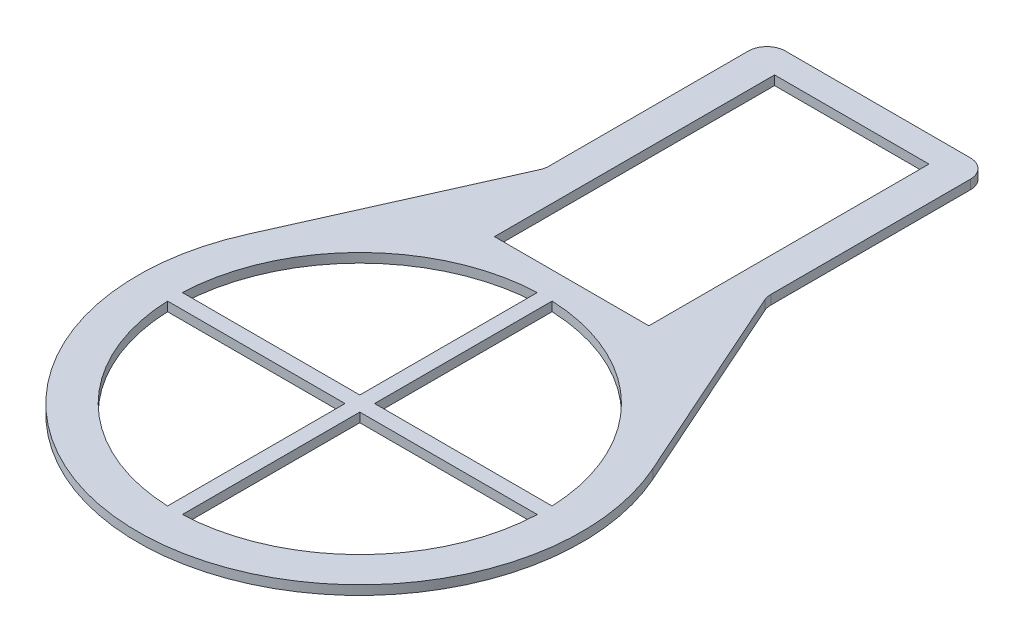
from build123d import *

# Parameters (mm, degrees)
SKETCH1_R           = 76.2
SKETCH1_W           = 76.2
SKETCH1_H           = 76.2
BOSS_EXTRUDE1_DEPTH = 3.175
FILLET1_R           = 6.35
CUT_EXTRUDE1_DEPTH  = 3.175
SKETCH3_W           = 52.989505278
SKETCH3_H           = 96.128397395
CUT_EXTRUDE2_DEPTH  = 3.175


with BuildPart() as part:
    # Sketch1 → Boss-Extrude1 (new body)
    with BuildSketch(Plane(origin=(0, 0, 0), x_dir=(1, 0, 0), z_dir=(0, 1, 0))):
        Circle(SKETCH1_R)
        with BuildLine():
            Line((38.1, 101.6), (-38.1, 101.6))
            Line((-38.1, 101.6), (-69.5842745, 31.055897063))
            ThreePointArc((-69.5842745, 31.055897063), (0, 76.2), (69.5842745, 31.055897063))
            Line((69.5842745, 31.055897063), (38.1, 101.6))
        make_face()
        with Locations((0, 139.7)):
            Rectangle(SKETCH1_W, SKETCH1_H)
    extrude(amount=BOSS_EXTRUDE1_DEPTH)

    # Fillet1
    fillet1_edges = [part.edges().sort_by_distance(p)[0] for p in [
        (-38.1, 1.5875, -101.6),
        (-38.1, 1.5875, -177.8),
        (38.1, 1.5875, -177.8),
        (38.1, 1.5875, -101.6),
    ]]
    fillet(fillet1_edges, radius=FILLET1_R)

    # Sketch2 → Cut-Extrude1 (cut)
    with BuildSketch(Plane(origin=(0, 3.175, 0), x_dir=(1, 0, 0), z_dir=(0, 1, 0))):
        with BuildLine():
            Line((-63.449179664, 2.54), (-2.54, 2.54))
            Line((-2.54, 2.54), (-2.54, 63.449179664))
            ThreePointArc((-2.54, 63.449179664), (-44.901280605, 44.901280605), (-63.449179664, 2.54))
        make_face()
        with BuildLine():
            Line((2.54, 63.449179664), (2.54, 2.54))
            Line((2.54, 2.54), (63.449179664, 2.54))
            ThreePointArc((63.449179664, 2.54), (44.901280605, 44.901280605), (2.54, 63.449179664))
        make_face()
        with BuildLine():
            Line((63.449179664, -2.54), (2.54, -2.54))
            Line((2.54, -2.54), (2.54, -63.449179664))
            ThreePointArc((2.54, -63.449179664), (44.901280605, -44.901280605), (63.449179664, -2.54))
        make_face()
        with BuildLine():
            Line((-2.54, -63.449179664), (-2.54, -2.54))
            Line((-2.54, -2.54), (-63.449179664, -2.54))
            ThreePointArc((-63.449179664, -2.54), (-44.901280605, -44.901280605), (-2.54, -63.449179664))
        make_face()
    extrude(amount=-CUT_EXTRUDE1_DEPTH, mode=Mode.SUBTRACT)

    # Sketch3 → Cut-Extrude2 (cut)
    with BuildSketch(Plane(origin=(0, 3.175, 0), x_dir=(1, 0, 0), z_dir=(0, 1, 0))):
        with Locations((0, 120.773321073)):
            Rectangle(SKETCH3_W, SKETCH3_H)
    extrude(amount=-CUT_EXTRUDE2_DEPTH, mode=Mode.SUBTRACT)


solid = part.part
